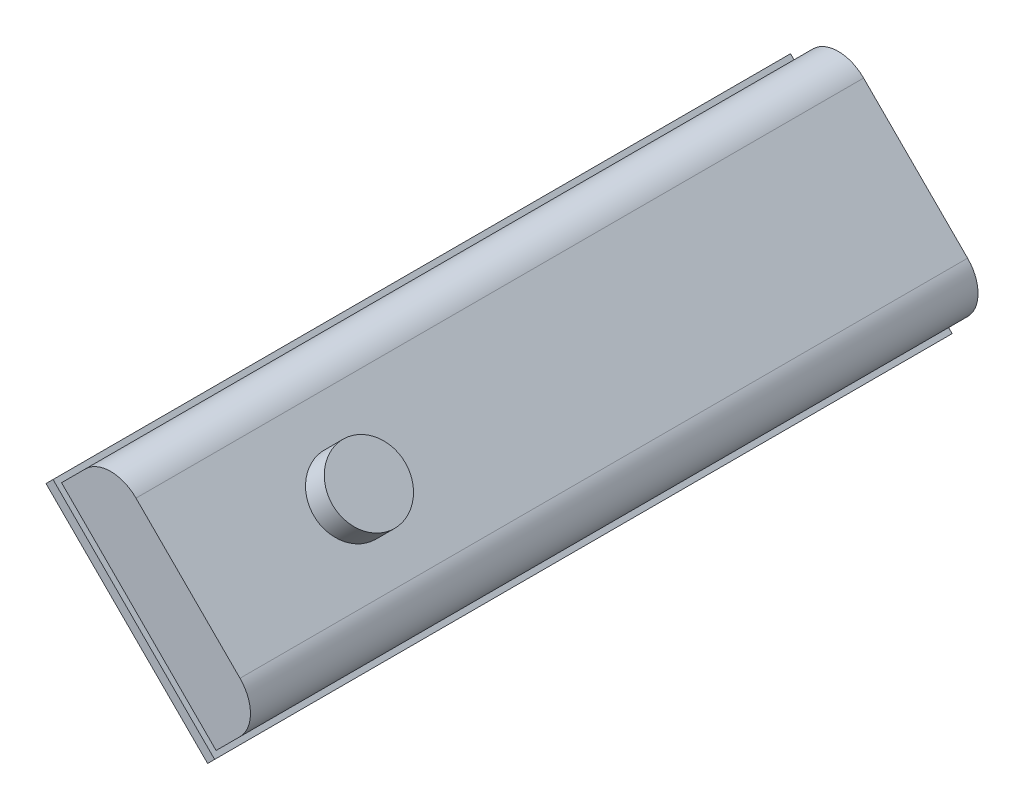
from build123d import *

# Parameters (mm, degrees)
COVER_START          = -375.38
COVER_DEPTH          = 439.28
RAIL_START           = -378.38
RAIL_FLANGE_DEPTH    = 445.28
SKETCH3_R            = 22
OIL_FILLER_CAP_DEPTH = 16


with BuildPart() as part:
    # Sketch1 → Cover (new body)
    with BuildSketch(Plane.XY.offset(COVER_START)):
        with BuildLine():
            Line((193.711902706, 287.049997823), (287.049997823, 193.711902706))
            Line((287.049997823, 193.711902706), (305.717616846, 212.379521729))
            ThreePointArc((305.717616846, 212.379521729), (312.044110372, 227.653028203), (305.717616846, 242.926534677))
            Line((305.717616846, 242.926534677), (242.926534677, 305.717616846))
            ThreePointArc((242.926534677, 305.717616846), (227.653028203, 312.044110372), (212.379521729, 305.717616846))
            Line((212.379521729, 305.717616846), (193.711902706, 287.049997823))
        make_face()
    extrude(amount=COVER_DEPTH)

    # Sketch2 → Rail Flange (add)
    with BuildSketch(Plane.XY.offset(RAIL_START)):
        Polygon((191.590582362, 289.171318166), (289.171318166, 191.590582362), (293.413958853, 195.83322305), (195.83322305, 293.413958853), align=None)
    extrude(amount=RAIL_FLANGE_DEPTH)

    # Sketch3 → Oil Filler Cap (add)
    with BuildSketch(Plane(origin=(274.322075761, 274.322075761, 0), x_dir=(0, 0, -1), z_dir=(0.7071067811865477, 0.7071067811865475, 0))):
        with Locations(Location((34, 0, 0), (0, 0, 270))):
            Circle(SKETCH3_R)
    extrude(amount=OIL_FILLER_CAP_DEPTH)


solid = part.part
